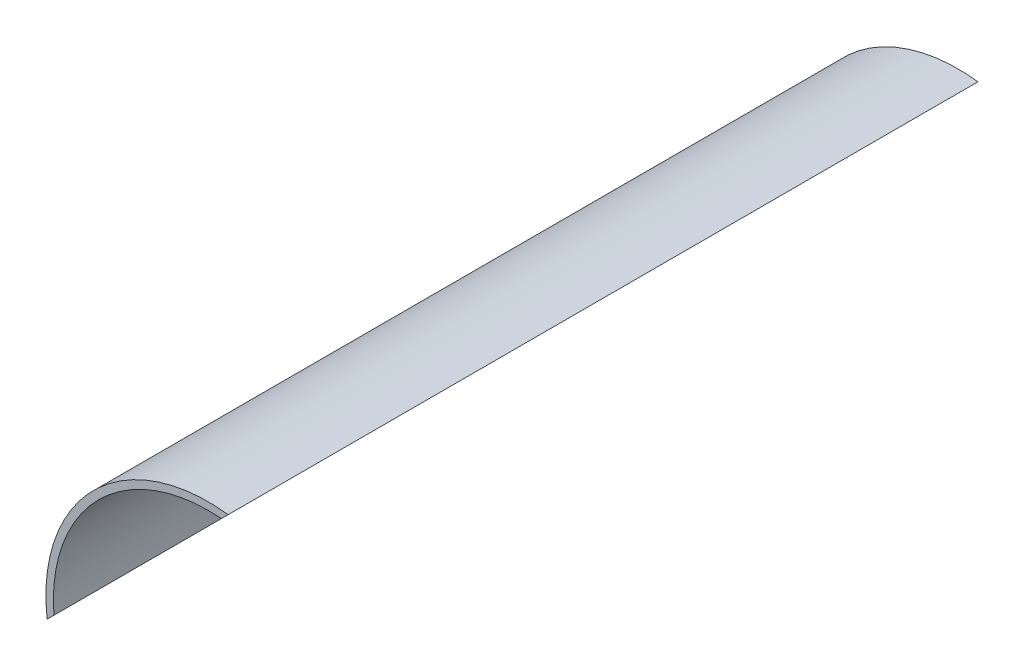
from build123d import *

# Parameters (mm, degrees)
SKETCH1_R           = 65
SKETCH1_R_2         = 62
BOSS_EXTRUDE1_DEPTH = 300
SKETCH4_W           = 130
SKETCH4_H           = 300
CUT_EXTRUDE4_DEPTH  = 516


with BuildPart() as part:
    # Sketch1 → Boss-Extrude1 (new body)
    with BuildSketch(Plane.XY):
        Circle(SKETCH1_R)
        Circle(SKETCH1_R_2, mode=Mode.SUBTRACT)
    extrude(amount=BOSS_EXTRUDE1_DEPTH)

    # Sketch4 → Cut-Extrude4 (cut)
    with BuildSketch(Plane(origin=(-28.284271247, 28.284271247, 0), x_dir=(0.7071067811865477, 0.7071067811865475, 0), z_dir=(-0.7071067811865475, 0.7071067811865477, 0))):
        with Locations((0, -150)):
            Rectangle(SKETCH4_W, SKETCH4_H)
    extrude(amount=-CUT_EXTRUDE4_DEPTH, mode=Mode.SUBTRACT)


solid = part.part
